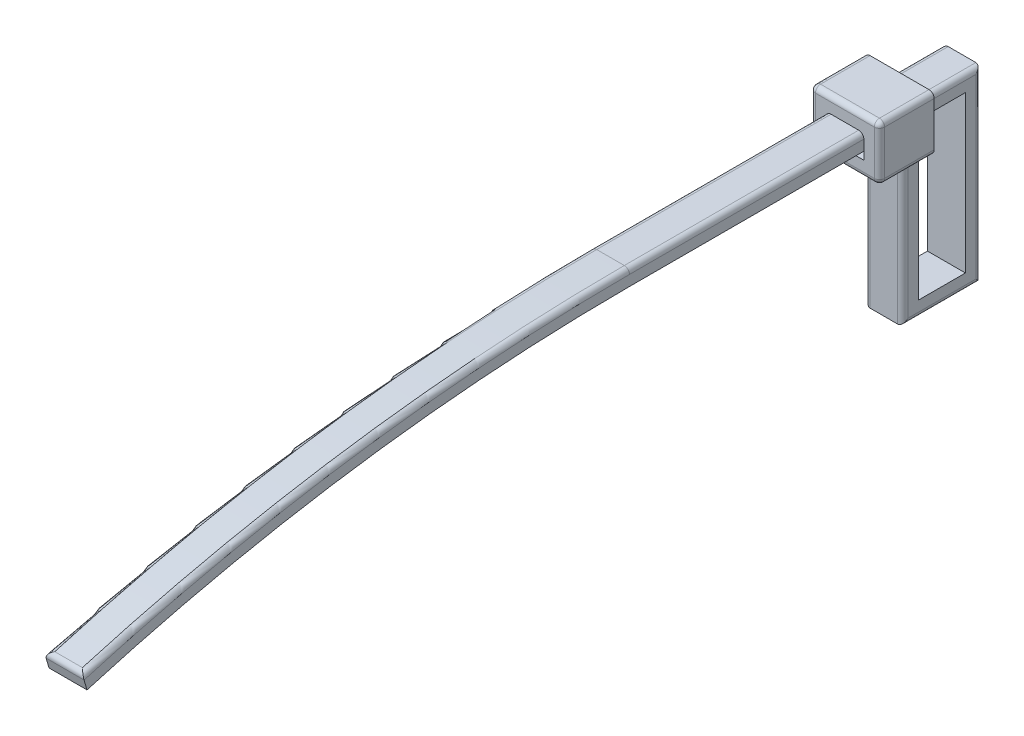
from build123d import *

# Parameters (mm, degrees)
ESQUISSE1_W             = 3
ESQUISSE1_H             = 10
BOSS_EXTRU_1_DEPTH      = 2.43
BOSS_EXTRU_2_DEPTH      = 1
BOSS_EXTRU_3_DEPTH      = 1
CONG_1_R                = 0.33
ESQUISSE4_W             = 2.43
ESQUISSE4_H             = 0.5
ENL_V_MAT_EXTRU_1_DEPTH = 2


with BuildPart() as part:
    # Esquisse1 → Boss.-Extru.1 (new body)
    # profile 1 of 2: a face of its own
    with BuildSketch(Plane(origin=(0, 0, 0), x_dir=(0, 0, -1), z_dir=(1, 0, 0))):
        Polygon((1, 12), (1, 13), (-2.5, 13), (-2.5, 12), (-17.5, 12), (-17.5, 11), (-2.5, 11), (-2.5, 9.5), (0, 9.5), (0, 0), (5, 0), (5, 12), align=None)
        with Locations((2.5, 6)):
            Rectangle(ESQUISSE1_W, ESQUISSE1_H, mode=Mode.SUBTRACT)
    # profile 2 of 2: a face of its own
    with BuildSketch(Plane(origin=(0, 0, 0), x_dir=(0, 0, -1), z_dir=(1, 0, 0))):
        with BuildLine():
            Line((-52.5, 6.95936039), (-52.217816297, 6))
            ThreePointArc((-52.217816297, 6), (-35.038007074, 9.743584715), (-17.5, 11))
            Line((-17.5, 11), (-17.5, 12))
            ThreePointArc((-17.5, 12), (-35.180554627, 10.73337267), (-52.5, 6.95936039))
        make_face()
    extrude(amount=BOSS_EXTRU_1_DEPTH)

    # Esquisse2 → Boss.-Extru.2 (add)
    with BuildSketch(Plane(origin=(2.43, 0, 0), x_dir=(0, 0, -1), z_dir=(1, 0, 0))):
        Polygon((-2.5, 13), (-2.5, 12), (-2.5, 11), (-2.5, 9.5), (0, 9.5), (1, 9.5), (1, 12), (1, 13), align=None)
    extrude(amount=BOSS_EXTRU_2_DEPTH)

    # Esquisse3 → Boss.-Extru.3 (add)
    with BuildSketch(Plane.ZY):
        Polygon((-1, 13), (-1, 12), (-1, 9.5), (0, 9.5), (2.5, 9.5), (2.5, 11), (2.5, 12), (2.5, 13), align=None)
    extrude(amount=BOSS_EXTRU_3_DEPTH)

    # Congé1
    cong_1_edges = [part.edges().sort_by_distance(p)[0] for p in [
        (0, 12, -3),
        (0, 6, -5),
        (0, 0, -2.5),
        (0, 4.75, 0),
        (0, 10.73337267, 35.180554627),
        (0, 12, 10),
        (1.215, 9.5, 2.5),
        (1.215, 6.95936039, 52.5),
        (1.215, 13, 2.5),
        (2.43, 12, 10),
        (2.43, 10.73337267, 35.180554627),
        (3.43, 13, 0.75),
        (3.43, 11.25, 2.5),
        (3.43, 9.5, 0.75),
        (2.43, 4.75, 0),
        (2.43, 0, -2.5),
        (2.43, 6, -5),
        (-1, 11.25, 2.5),
        (-1, 13, 0.75),
        (-1, 9.5, 0.75),
        (2.43, 12, -3),
    ]]
    fillet(cong_1_edges, radius=CONG_1_R)

    # Esquisse4 → Enlèv. mat.-Extru.1 (cut)
    with BuildSketch(Plane.XY.offset(2.5)):
        with Locations((1.215, 10.75)):
            Rectangle(ESQUISSE4_W, ESQUISSE4_H)
    extrude(amount=-ENL_V_MAT_EXTRU_1_DEPTH, mode=Mode.SUBTRACT)


solid = part.part
